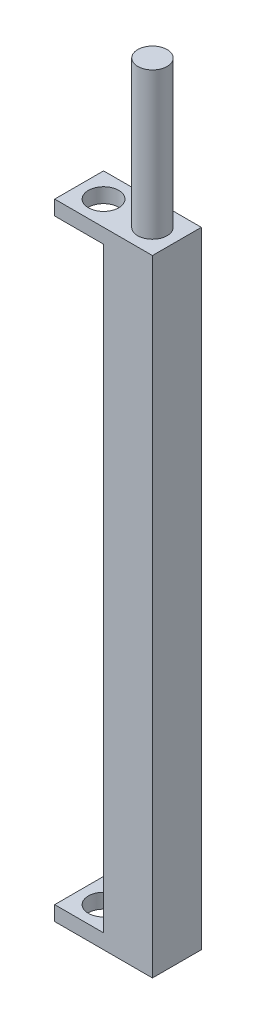
from build123d import *

# Parameters (mm, degrees)
SKETCH_2_W          = 10
SKETCH_2_H          = 5
EXTRUDE_1_DEPTH     = 1.5
SKETCH_3_R          = 1.55
CUT_EXTRUDE_1_DEPTH = 1.5
SKETCH_4_W          = 5
SKETCH_4_H          = 5
EXTRUDE_2_DEPTH     = 61
SKETCH_5_W          = 10
SKETCH_5_H          = 5
EXTRUDE_3_DEPTH     = 1.5
SKETCH_6_R          = 1.55
CUT_EXTRUDE_2_DEPTH = 1.5
SKETCH_7_R          = 1.5
EXTRUDE_4_DEPTH     = 15
SKETCH_11_R         = 1.55
CUT_EXTRUDE_3_DEPTH = 10


with BuildPart() as part:
    # 草图2 → 凸台-拉伸1 (new body)
    with BuildSketch(Plane(origin=(0, 0, 0), x_dir=(1, 0, 0), z_dir=(0, 1, 0))):
        Rectangle(SKETCH_2_W, SKETCH_2_H)
    extrude(amount=EXTRUDE_1_DEPTH)

    # 草图3 → 切除-拉伸1 (cut)
    with BuildSketch(Plane.XZ):
        with Locations(Location((-2.5, 0, 0), (0, 0, 270))):
            Circle(SKETCH_3_R)
    extrude(amount=-CUT_EXTRUDE_1_DEPTH, mode=Mode.SUBTRACT)

    # 草图4 → 凸台-拉伸2 (add)
    with BuildSketch(Plane.XZ):
        with Locations((2.5, 0)):
            Rectangle(SKETCH_4_W, SKETCH_4_H)
    extrude(amount=EXTRUDE_2_DEPTH)

    # 草图5 → 凸台-拉伸3 (add)
    with BuildSketch(Plane.XZ.offset(61)):
        Rectangle(SKETCH_5_W, SKETCH_5_H)
    extrude(amount=EXTRUDE_3_DEPTH)

    # 草图6 → 切除-拉伸2 (cut)
    with BuildSketch(Plane.XZ.offset(62.5)):
        with Locations(Location((-2.5, 0, 0), (0, 0, 270))):
            Circle(SKETCH_6_R)
    extrude(amount=-CUT_EXTRUDE_2_DEPTH, mode=Mode.SUBTRACT)

    # 草图7 → 凸台-拉伸4 (add)
    with BuildSketch(Plane(origin=(0, 1.5, 0), x_dir=(1, 0, 0), z_dir=(0, 1, 0))):
        with Locations(Location((2.5, 0, 0), (0, 0, 270))):
            Circle(SKETCH_7_R)
    extrude(amount=EXTRUDE_4_DEPTH)

    # 草图11 → 切除-拉伸3 (cut)
    with BuildSketch(Plane.XZ.offset(62.5)):
        with Locations(Location((2.5, 0, 0), (0, 0, 270))):
            Circle(SKETCH_11_R)
    extrude(amount=-CUT_EXTRUDE_3_DEPTH, mode=Mode.SUBTRACT)


solid = part.part
